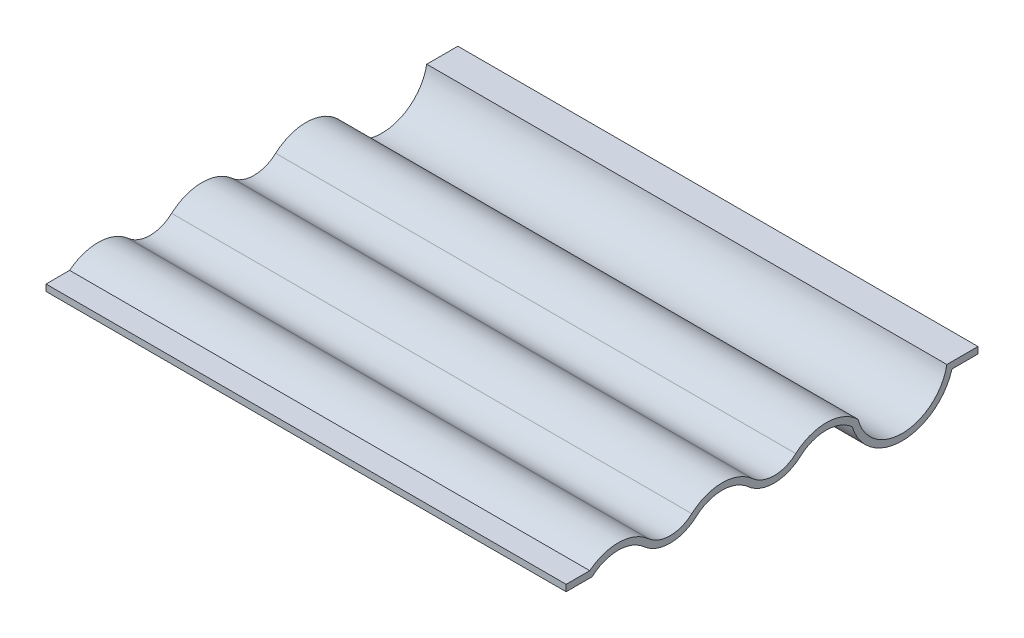
from build123d import *

# Parameters (mm, degrees)
BOSS_EXTRUDE4_DEPTH = 254


with BuildPart() as part:
    # Sketch1 → Boss-Extrude4 (new body)
    with BuildSketch(Plane(origin=(0, 0, 0), x_dir=(0, 0, -1), z_dir=(1, 0, 0))):
        with BuildLine():
            Line((-76.879940582, 0), (-89.563831565, 0))
            Line((-89.563831565, 0), (-89.563831565, 3.175))
            Line((-89.563831565, 3.175), (-78.039725897, 3.175))
            ThreePointArc((-78.039725897, 3.175), (-63.553584925, 8.017140461), (-49.363273916, 2.366505276))
            ThreePointArc((-49.363273916, 2.366505276), (-38.779940582, -1.675968343), (-28.196607249, 2.366505276))
            ThreePointArc((-28.196607249, 2.366505276), (-13.379940582, 8.025968343), (1.436726084, 2.366505276))
            ThreePointArc((1.436726084, 2.366505276), (12.020059418, -1.675968343), (22.603392751, 2.366505276))
            ThreePointArc((22.603392751, 2.366505276), (37.905111105, 8.020674683), (52.945511479, 1.704142972))
            ThreePointArc((52.945511479, 1.704142972), (75.245720478, -15.063067291), (96.359970712, 3.175))
            Line((96.359970712, 3.175), (111.566304511, 3.175))
            Line((111.566304511, 3.175), (111.566304511, 0))
            Line((111.566304511, 0), (98.866304511, 0))
            ThreePointArc((98.866304511, 0), (74.493181964, -18.250811422), (50.120059418, 0))
            ThreePointArc((50.120059418, 0), (37.420059418, 4.850968343), (24.720059418, 0))
            ThreePointArc((24.720059418, 0), (12.020059418, -4.850968343), (-0.679940582, 0))
            ThreePointArc((-0.679940582, 0), (-13.379940582, 4.850968343), (-26.079940582, 0))
            ThreePointArc((-26.079940582, 0), (-38.779940582, -4.850968343), (-51.479940582, 0))
            ThreePointArc((-51.479940582, 0), (-64.179940582, 4.850968343), (-76.879940582, 0))
        make_face()
    extrude(amount=BOSS_EXTRUDE4_DEPTH)


solid = part.part
